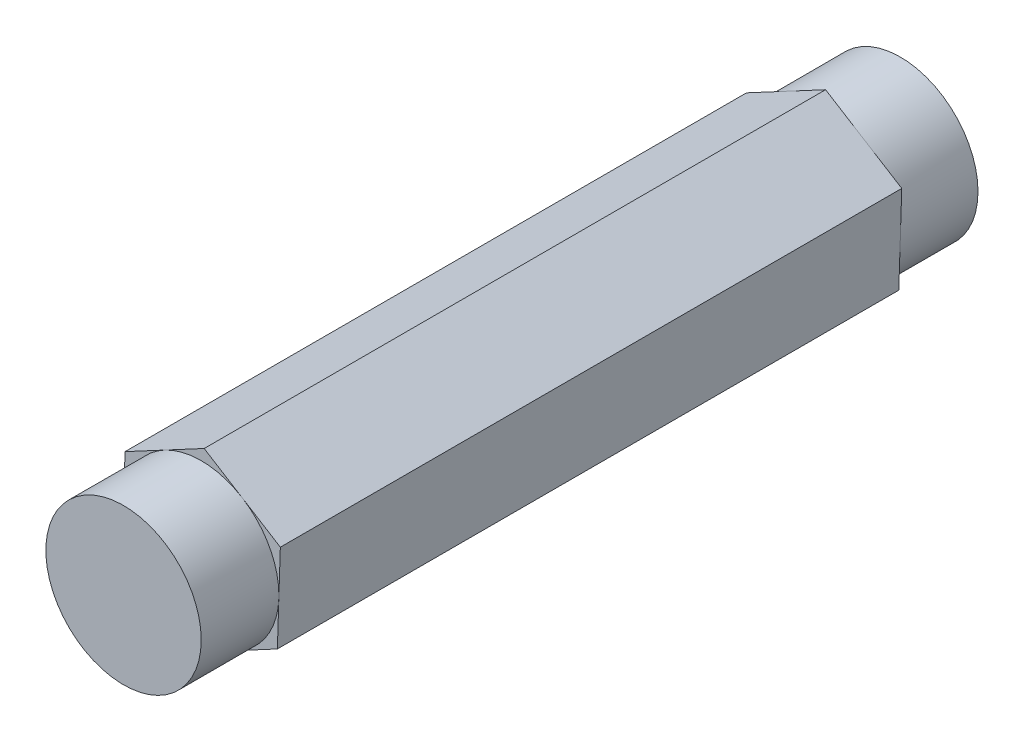
from build123d import *

# Parameters (mm, degrees)
BOSS_EXTRUDE1_DEPTH      = 2
BOSS_EXTRUDE2_DEPTH      = 0.25
BOSS_EXTRUDE2_DEPTH_BACK = 2.25
SKETCH2_R                = 0.25


with BuildPart() as part:
    # Sketch1 → Boss-Extrude1 (new body)
    with BuildSketch(Plane.XY):
        Polygon((-0.24510172, 0.152507312), (-0.254626066, -0.13601066), (-0.009524346, -0.288517972), (0.24510172, -0.152507312), (0.254626066, 0.13601066), (0.009524346, 0.288517972), align=None)
    extrude(amount=BOSS_EXTRUDE1_DEPTH)

    # Sketch2 → Boss-Extrude2 (add, two sides: drawn at the far end of the back side and taken through both)
    with BuildSketch(Plane.XY.offset(2).offset(-BOSS_EXTRUDE2_DEPTH_BACK)):
        Circle(SKETCH2_R)
    extrude(amount=BOSS_EXTRUDE2_DEPTH + BOSS_EXTRUDE2_DEPTH_BACK)


solid = part.part
